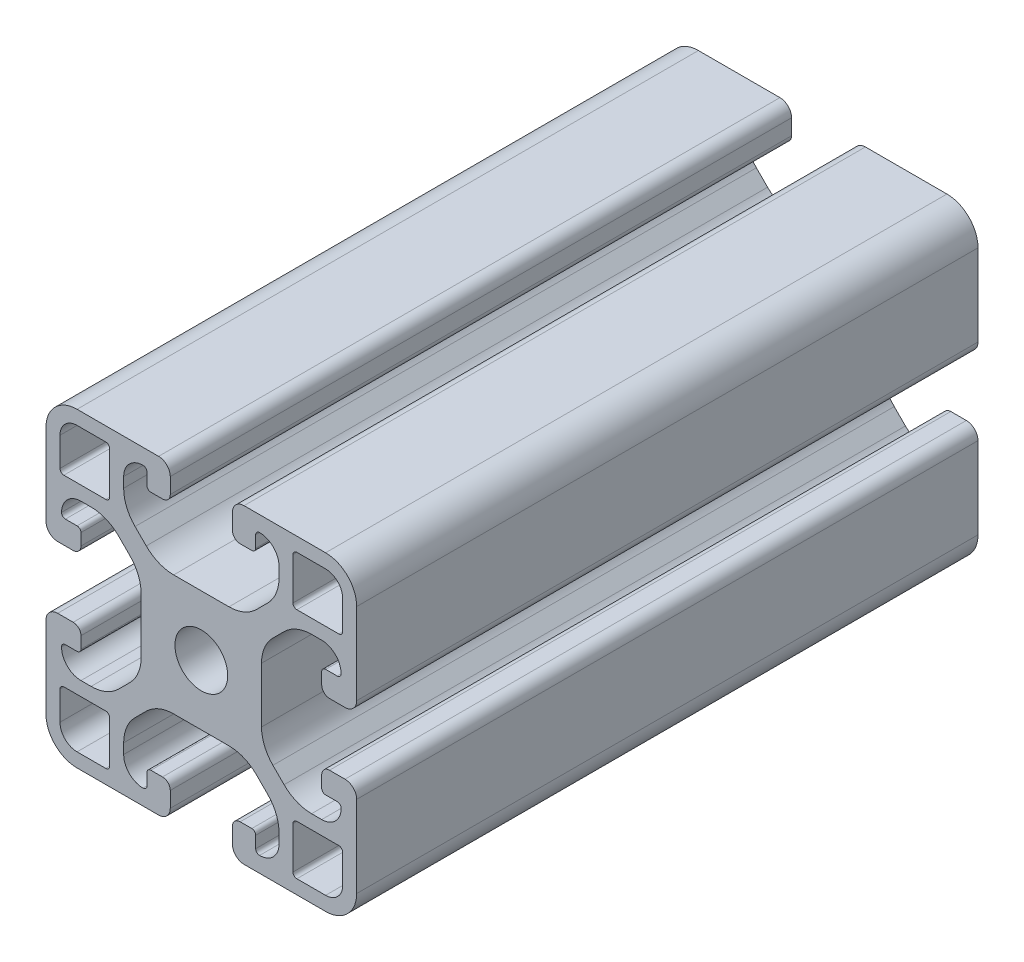
from build123d import *

# Parameters (mm, degrees)
ESQUISSE1_R        = 3.4
BOSS_EXTRU_1_DEPTH = 80


with BuildPart() as part:
    # Esquisse1 → Boss.-Extru.1 (new body)
    with BuildSketch(Plane(origin=(0, 0, -30), x_dir=(-1, 0, 0), z_dir=(0, 0, -1))):
        with BuildLine():
            Line((-4.5, 15), (-4.5, 13.5))
            ThreePointArc((-4.5, 13.5), (-4.353553391, 13.146446609), (-4, 13))
            Line((-4, 13), (-2.5, 13))
            ThreePointArc((-2.5, 13), (-2.146446609, 12.853553391), (-2, 12.5))
            ThreePointArc((-2, 12.5), (-2.732233047, 10.732233047), (-4.5, 10))
            Line((-4.5, 10), (-5.807611845, 10))
            ThreePointArc((-5.807611845, 10), (-7.721029006, 10.380602337), (-9.343145751, 11.464466094))
            Line((-9.343145751, 11.464466094), (-10.785533906, 12.906854249))
            ThreePointArc((-10.785533906, 12.906854249), (-11.869397663, 14.528970994), (-12.25, 16.442388155))
            Line((-12.25, 16.442388155), (-12.25, 23.557611845))
            ThreePointArc((-12.25, 23.557611845), (-11.869397663, 25.471029006), (-10.785533906, 27.093145751))
            Line((-10.785533906, 27.093145751), (-9.343145751, 28.535533906))
            ThreePointArc((-9.343145751, 28.535533906), (-7.721029006, 29.619397663), (-5.807611845, 30))
            Line((-5.807611845, 30), (-4.5, 30))
            ThreePointArc((-4.5, 30), (-2.732233047, 29.267766953), (-2, 27.5))
            ThreePointArc((-2, 27.5), (-2.146446609, 27.146446609), (-2.5, 27))
            Line((-2.5, 27), (-4, 27))
            ThreePointArc((-4, 27), (-4.353553391, 26.853553391), (-4.5, 26.5))
            Line((-4.5, 26.5), (-4.5, 25))
            ThreePointArc((-4.5, 25), (-4.207106781, 24.292893219), (-3.5, 24))
            Line((-3.5, 24), (-1.5, 24))
            ThreePointArc((-1.5, 24), (-0.439339828, 24.439339828), (0, 25.5))
            Line((0, 25.5), (0, 36))
            ThreePointArc((0, 36), (-1.171572875, 38.828427125), (-4, 40))
            Line((-4, 40), (-14.5, 40))
            ThreePointArc((-14.5, 40), (-15.560660172, 39.560660172), (-16, 38.5))
            Line((-16, 38.5), (-16, 36.5))
            ThreePointArc((-16, 36.5), (-15.707106781, 35.792893219), (-15, 35.5))
            Line((-15, 35.5), (-13.5, 35.5))
            ThreePointArc((-13.5, 35.5), (-13.146446609, 35.646446609), (-13, 36))
            Line((-13, 36), (-13, 37.5))
            ThreePointArc((-13, 37.5), (-12.853553391, 37.853553391), (-12.5, 38))
            ThreePointArc((-12.5, 38), (-10.732233047, 37.267766953), (-10, 35.5))
            Line((-10, 35.5), (-10, 34.192388155))
            ThreePointArc((-10, 34.192388155), (-10.380602337, 32.278970994), (-11.464466094, 30.656854249))
            Line((-11.464466094, 30.656854249), (-12.906854249, 29.214466094))
            ThreePointArc((-12.906854249, 29.214466094), (-14.528970994, 28.130602337), (-16.442388155, 27.75))
            Line((-16.442388155, 27.75), (-23.557611845, 27.75))
            ThreePointArc((-23.557611845, 27.75), (-25.471029006, 28.130602337), (-27.093145751, 29.214466094))
            Line((-27.093145751, 29.214466094), (-28.535533906, 30.656854249))
            ThreePointArc((-28.535533906, 30.656854249), (-29.619397663, 32.278970994), (-30, 34.192388155))
            Line((-30, 34.192388155), (-30, 35.5))
            ThreePointArc((-30, 35.5), (-29.267766953, 37.267766953), (-27.5, 38))
            ThreePointArc((-27.5, 38), (-27.146446609, 37.853553391), (-27, 37.5))
            Line((-27, 37.5), (-27, 36))
            ThreePointArc((-27, 36), (-26.853553391, 35.646446609), (-26.5, 35.5))
            Line((-26.5, 35.5), (-25, 35.5))
            ThreePointArc((-25, 35.5), (-24.292893219, 35.792893219), (-24, 36.5))
            Line((-24, 36.5), (-24, 38.5))
            ThreePointArc((-24, 38.5), (-24.439339828, 39.560660172), (-25.5, 40))
            Line((-25.5, 40), (-36, 40))
            ThreePointArc((-36, 40), (-38.828427125, 38.828427125), (-40, 36))
            Line((-40, 36), (-40, 25.5))
            ThreePointArc((-40, 25.5), (-39.560660172, 24.439339828), (-38.5, 24))
            Line((-38.5, 24), (-36.5, 24))
            ThreePointArc((-36.5, 24), (-35.792893219, 24.292893219), (-35.5, 25))
            Line((-35.5, 25), (-35.5, 26.5))
            ThreePointArc((-35.5, 26.5), (-35.646446609, 26.853553391), (-36, 27))
            Line((-36, 27), (-37.5, 27))
            ThreePointArc((-37.5, 27), (-37.853553391, 27.146446609), (-38, 27.5))
            ThreePointArc((-38, 27.5), (-37.267766953, 29.267766953), (-35.5, 30))
            Line((-35.5, 30), (-34.192388155, 30))
            ThreePointArc((-34.192388155, 30), (-32.278970994, 29.619397663), (-30.656854249, 28.535533906))
            Line((-30.656854249, 28.535533906), (-29.214466094, 27.093145751))
            ThreePointArc((-29.214466094, 27.093145751), (-28.130602337, 25.471029006), (-27.75, 23.557611845))
            Line((-27.75, 23.557611845), (-27.75, 16.442388155))
            ThreePointArc((-27.75, 16.442388155), (-28.130602337, 14.528970994), (-29.214466094, 12.906854249))
            Line((-29.214466094, 12.906854249), (-30.656854249, 11.464466094))
            ThreePointArc((-30.656854249, 11.464466094), (-32.278970994, 10.380602337), (-34.192388155, 10))
            Line((-34.192388155, 10), (-35.5, 10))
            ThreePointArc((-35.5, 10), (-37.267766953, 10.732233047), (-38, 12.5))
            ThreePointArc((-38, 12.5), (-37.853553391, 12.853553391), (-37.5, 13))
            Line((-37.5, 13), (-36, 13))
            ThreePointArc((-36, 13), (-35.646446609, 13.146446609), (-35.5, 13.5))
            Line((-35.5, 13.5), (-35.5, 15))
            ThreePointArc((-35.5, 15), (-35.792893219, 15.707106781), (-36.5, 16))
            Line((-36.5, 16), (-38.5, 16))
            ThreePointArc((-38.5, 16), (-39.560660172, 15.560660172), (-40, 14.5))
            Line((-40, 14.5), (-40, 4))
            ThreePointArc((-40, 4), (-38.828427125, 1.171572875), (-36, 0))
            Line((-36, 0), (-25.5, 0))
            ThreePointArc((-25.5, 0), (-24.439339828, 0.439339828), (-24, 1.5))
            Line((-24, 1.5), (-24, 3.5))
            ThreePointArc((-24, 3.5), (-24.292893219, 4.207106781), (-25, 4.5))
            Line((-25, 4.5), (-26.5, 4.5))
            ThreePointArc((-26.5, 4.5), (-26.853553391, 4.353553391), (-27, 4))
            Line((-27, 4), (-27, 2.5))
            ThreePointArc((-27, 2.5), (-27.146446609, 2.146446609), (-27.5, 2))
            ThreePointArc((-27.5, 2), (-29.267766953, 2.732233047), (-30, 4.5))
            Line((-30, 4.5), (-30, 5.807611845))
            ThreePointArc((-30, 5.807611845), (-29.619397663, 7.721029006), (-28.535533906, 9.343145751))
            Line((-28.535533906, 9.343145751), (-27.093145751, 10.785533906))
            ThreePointArc((-27.093145751, 10.785533906), (-25.471029006, 11.869397663), (-23.557611845, 12.25))
            Line((-23.557611845, 12.25), (-16.442388155, 12.25))
            ThreePointArc((-16.442388155, 12.25), (-14.528970994, 11.869397663), (-12.906854249, 10.785533906))
            Line((-12.906854249, 10.785533906), (-11.464466094, 9.343145751))
            ThreePointArc((-11.464466094, 9.343145751), (-10.380602337, 7.721029006), (-10, 5.807611845))
            Line((-10, 5.807611845), (-10, 4.5))
            ThreePointArc((-10, 4.5), (-10.732233047, 2.732233047), (-12.5, 2))
            ThreePointArc((-12.5, 2), (-12.853553391, 2.146446609), (-13, 2.5))
            Line((-13, 2.5), (-13, 4))
            ThreePointArc((-13, 4), (-13.146446609, 4.353553391), (-13.5, 4.5))
            Line((-13.5, 4.5), (-15, 4.5))
            ThreePointArc((-15, 4.5), (-15.707106781, 4.207106781), (-16, 3.5))
            Line((-16, 3.5), (-16, 1.5))
            ThreePointArc((-16, 1.5), (-15.560660172, 0.439339828), (-14.5, 0))
            Line((-14.5, 0), (-4, 0))
            ThreePointArc((-4, 0), (-1.171572875, 1.171572875), (0, 4))
            Line((0, 4), (0, 14.5))
            ThreePointArc((0, 14.5), (-0.439339828, 15.560660172), (-1.5, 16))
            Line((-1.5, 16), (-3.5, 16))
            ThreePointArc((-3.5, 16), (-4.207106781, 15.707106781), (-4.5, 15))
        make_face()
        with Locations(Location((-20, 20, 0), (0, 0, 180))):
            Circle(ESQUISSE1_R, mode=Mode.SUBTRACT)
        with BuildLine():
            Line((-4, 1.8), (-7.7, 1.8))
            ThreePointArc((-7.7, 1.8), (-8.053553391, 1.946446609), (-8.2, 2.3))
            Line((-8.2, 2.3), (-8.2, 7.7))
            ThreePointArc((-8.2, 7.7), (-8.053553391, 8.053553391), (-7.7, 8.2))
            Line((-7.7, 8.2), (-2.3, 8.2))
            ThreePointArc((-2.3, 8.2), (-1.946446609, 8.053553391), (-1.8, 7.7))
            Line((-1.8, 7.7), (-1.8, 4))
            ThreePointArc((-1.8, 4), (-2.444365081, 2.444365081), (-4, 1.8))
        make_face(mode=Mode.SUBTRACT)
        with BuildLine():
            Line((-38.2, 4), (-38.2, 7.7))
            ThreePointArc((-38.2, 7.7), (-38.053553391, 8.053553391), (-37.7, 8.2))
            Line((-37.7, 8.2), (-32.3, 8.2))
            ThreePointArc((-32.3, 8.2), (-31.946446609, 8.053553391), (-31.8, 7.7))
            Line((-31.8, 7.7), (-31.8, 2.3))
            ThreePointArc((-31.8, 2.3), (-31.946446609, 1.946446609), (-32.3, 1.8))
            Line((-32.3, 1.8), (-36, 1.8))
            ThreePointArc((-36, 1.8), (-37.555634919, 2.444365081), (-38.2, 4))
        make_face(mode=Mode.SUBTRACT)
        with BuildLine():
            Line((-36, 38.2), (-32.3, 38.2))
            ThreePointArc((-32.3, 38.2), (-31.946446609, 38.053553391), (-31.8, 37.7))
            Line((-31.8, 37.7), (-31.8, 32.3))
            ThreePointArc((-31.8, 32.3), (-31.946446609, 31.946446609), (-32.3, 31.8))
            Line((-32.3, 31.8), (-37.7, 31.8))
            ThreePointArc((-37.7, 31.8), (-38.053553391, 31.946446609), (-38.2, 32.3))
            Line((-38.2, 32.3), (-38.2, 36))
            ThreePointArc((-38.2, 36), (-37.555634919, 37.555634919), (-36, 38.2))
        make_face(mode=Mode.SUBTRACT)
        with BuildLine():
            Line((-1.8, 36), (-1.8, 32.3))
            ThreePointArc((-1.8, 32.3), (-1.946446609, 31.946446609), (-2.3, 31.8))
            Line((-2.3, 31.8), (-7.7, 31.8))
            ThreePointArc((-7.7, 31.8), (-8.053553391, 31.946446609), (-8.2, 32.3))
            Line((-8.2, 32.3), (-8.2, 37.7))
            ThreePointArc((-8.2, 37.7), (-8.053553391, 38.053553391), (-7.7, 38.2))
            Line((-7.7, 38.2), (-4, 38.2))
            ThreePointArc((-4, 38.2), (-2.444365081, 37.555634919), (-1.8, 36))
        make_face(mode=Mode.SUBTRACT)
    extrude(amount=-BOSS_EXTRU_1_DEPTH)


solid = part.part
